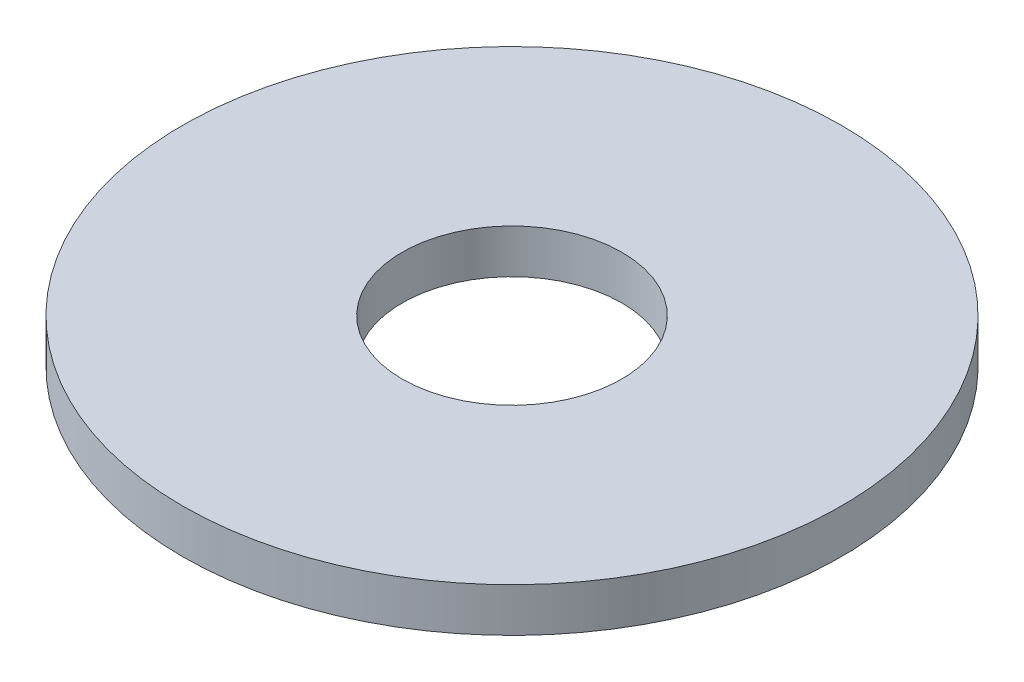
from build123d import *

# Parameters (mm, degrees)
ESQUISSE1_R        = 15
ESQUISSE1_R_2      = 5
BOSS_EXTRU_1_DEPTH = 2


with BuildPart() as part:
    # Esquisse1 → Boss.-Extru.1 (new body)
    with BuildSketch(Plane(origin=(0, 0, 0), x_dir=(1, 0, 0), z_dir=(0, 1, 0))):
        with Locations(Location((69.539780937, 133.635963101, 0), (0, 0, 270))):
            Circle(ESQUISSE1_R)
        with Locations(Location((69.539780937, 133.635963101, 0), (0, 0, 270))):
            Circle(ESQUISSE1_R_2, mode=Mode.SUBTRACT)
    extrude(amount=BOSS_EXTRU_1_DEPTH)


solid = part.part
